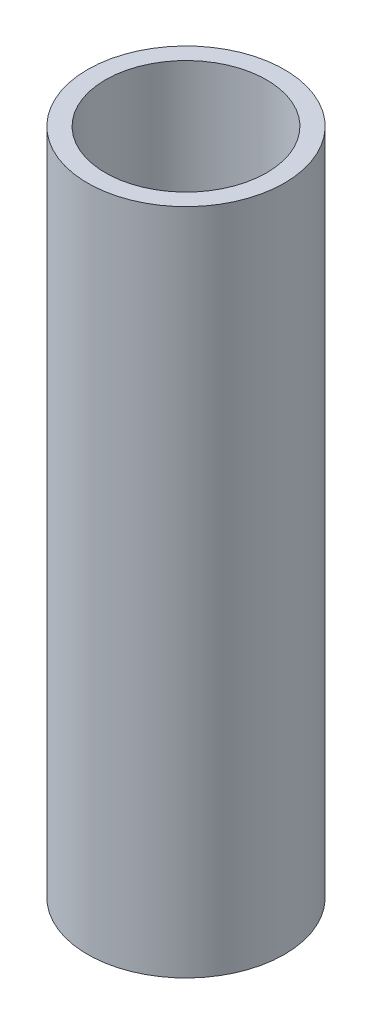
from build123d import *

# Parameters (mm, degrees)
SKETCH1_R           = 0.7366
SKETCH1_R_2         = 0.60325
BOSS_EXTRUDE1_DEPTH = 5


with BuildPart() as part:
    # Sketch1 → Boss-Extrude1 (new body)
    with BuildSketch(Plane.XZ.offset(-33.855553723)):
        with Locations(Location((0.7, -1.6, 0), (0, 0, 180))):
            Circle(SKETCH1_R)
        with Locations(Location((0.7, -1.6, 0), (0, 0, 180))):
            Circle(SKETCH1_R_2, mode=Mode.SUBTRACT)
    extrude(amount=BOSS_EXTRUDE1_DEPTH)


solid = part.part
